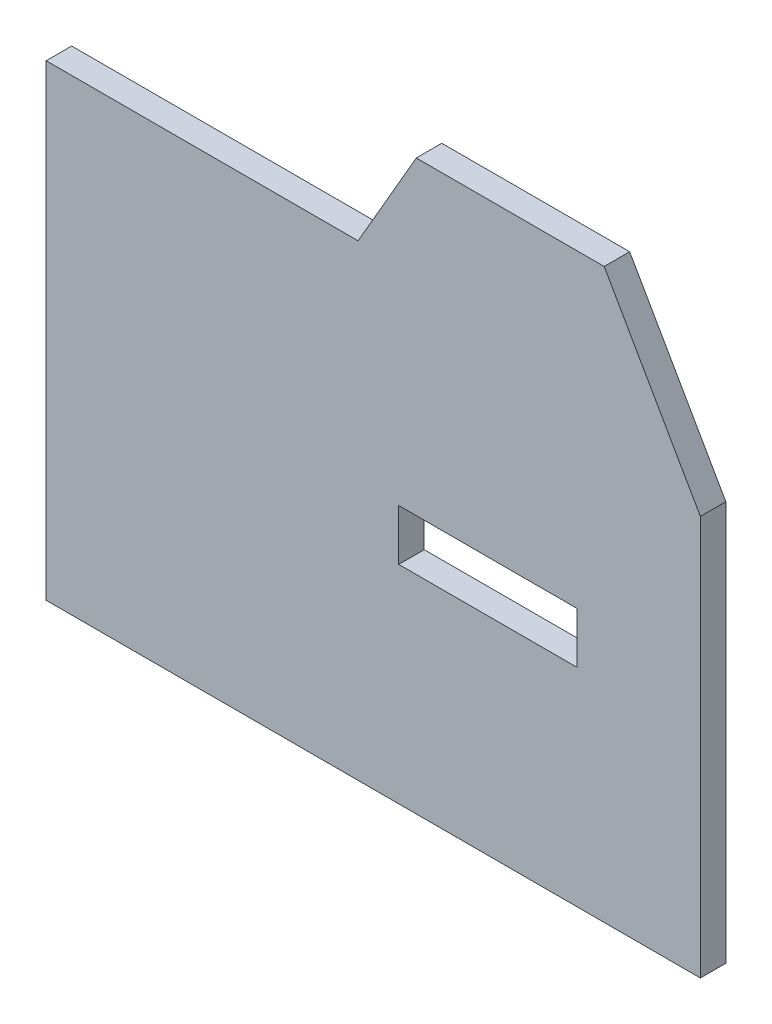
from build123d import *

# Parameters (mm, degrees)
BOSS_EXTRUDE1_DEPTH = 3
SKETCH3_W           = 21
SKETCH3_H           = 6
CUT_EXTRUDE1_DEPTH  = 10


with BuildPart() as part:
    # Sketch2 → Boss-Extrude1 (new body)
    with BuildSketch(Plane.XY):
        Polygon((0, 0), (77, 0), (77, 47.04888), (65.6794, 66.86939), (43.56615, 66.86939), (36.71335, 55), (0, 55), align=None)
    extrude(amount=BOSS_EXTRUDE1_DEPTH)

    # Sketch3 → Cut-Extrude1 (cut)
    with BuildSketch(Plane(origin=(0, 0, 0), x_dir=(-1, 0, 0), z_dir=(0, 0, -1))):
        with Locations((-52, 27.41)):
            Rectangle(SKETCH3_W, SKETCH3_H)
    extrude(amount=-CUT_EXTRUDE1_DEPTH, mode=Mode.SUBTRACT)


solid = part.part
